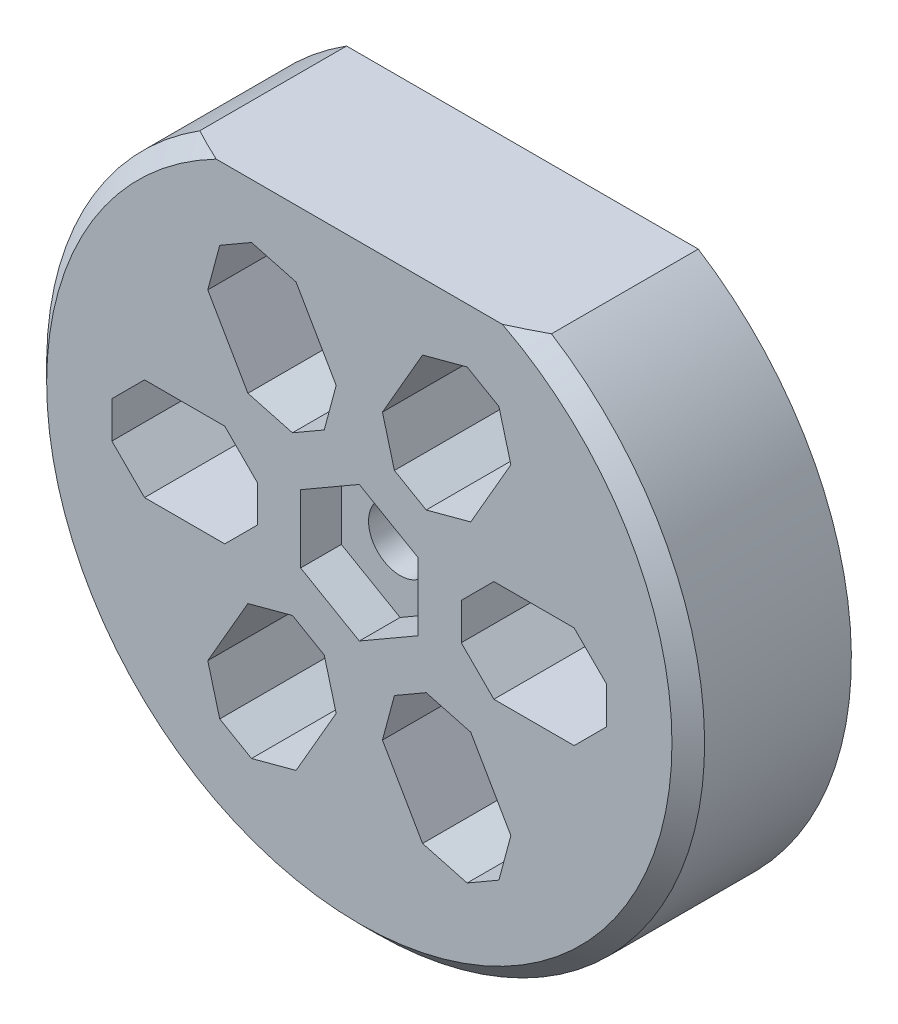
from build123d import *

# Parameters (mm, degrees)
BOSS_EXTRUDE1_DEPTH     = 12.7
CHAMFER1_SIZE           = 1.27
CUT_EXTRUDE1_DEPTH      = 3.175
F_8_CLEARANCE_HOLE1_D   = 4.9149
SKETCH5_W               = 11.3284
SKETCH5_H               = 7.9375
CUT_EXTRUDE_THIN1_DEPTH = 39.388001584
CHAMFER2_SIZE           = 2.54


with BuildPart() as part:
    # Sketch1 → Boss-Extrude1 (new body)
    with BuildSketch(Plane.XY):
        with BuildLine():
            Line((13.693796063, 21.648424474), (-13.693796063, 21.648424474))
            ThreePointArc((-13.693796063, 21.648424474), (0, -25.6159), (13.693796063, 21.648424474))
        make_face()
    extrude(amount=BOSS_EXTRUDE1_DEPTH)

    # Chamfer1
    chamfer1_edges = [part.edges().sort_by_distance(p)[0] for p in [
        (0, -25.6159, 12.7),
    ]]
    chamfer(chamfer1_edges, length=CHAMFER1_SIZE)

    # Sketch2 → Cut-Extrude1 (cut)
    with BuildSketch(Plane.XY.offset(12.7)):
        Polygon((-4.572, -2.639645431), (0, -5.279290861), (4.572, -2.639645431), (4.572, 2.639645431), (0, 5.279290861), (-4.572, 2.639645431), align=None)
    extrude(amount=-CUT_EXTRUDE1_DEPTH, mode=Mode.SUBTRACT)

    # #8 Clearance Hole1 (through all)
    with Locations(Plane.XY.offset(12.7)):
        with Locations((0, 0)):
            Hole(F_8_CLEARANCE_HOLE1_D / 2)

    # Sketch5 → Cut-Extrude-Thin1 (cut, through all)
    with BuildSketch(Plane.XY.offset(12.7)):
        Polygon((-7.405788321, -4.889701643), (-13.069988321, -14.700383827), (-6.195911679, -18.669133827), (-0.531711679, -8.858451643), align=None)
        with Locations((-13.6017, 0)):
            Rectangle(SKETCH5_W, SKETCH5_H)
        Polygon((-0.531711679, 8.858451643), (-6.195911679, 18.669133827), (-13.069988321, 14.700383827), (-7.405788321, 4.889701643), align=None)
        Polygon((7.405788321, 4.889701643), (13.069988321, 14.700383827), (6.195911679, 18.669133827), (0.531711679, 8.858451643), align=None)
        with Locations((13.6017, 0)):
            Rectangle(SKETCH5_W, SKETCH5_H)
        Polygon((0.531711679, -8.858451643), (6.195911679, -18.669133827), (13.069988321, -14.700383827), (7.405788321, -4.889701643), align=None)
    extrude(amount=-CUT_EXTRUDE_THIN1_DEPTH, mode=Mode.SUBTRACT)

    # Chamfer2
    chamfer2_edges = [part.edges().sort_by_distance(p)[0] for p in [
        (6.195911679, -18.669133827, 6.35),
        (0.531711679, -8.858451643, 6.35),
        (7.405788321, -4.889701643, 6.35),
        (13.069988321, -14.700383827, 6.35),
        (19.2659, -3.96875, 6.35),
        (7.9375, -3.96875, 6.35),
        (7.9375, 3.96875, 6.35),
        (19.2659, 3.96875, 6.35),
        (13.069988321, 14.700383827, 6.35),
        (7.405788321, 4.889701643, 6.35),
        (0.531711679, 8.858451643, 6.35),
        (6.195911679, 18.669133827, 6.35),
        (-6.195911679, 18.669133827, 6.35),
        (-0.531711679, 8.858451643, 6.35),
        (-7.405788321, 4.889701643, 6.35),
        (-13.069988321, 14.700383827, 6.35),
        (-19.2659, 3.96875, 6.35),
        (-7.9375, 3.96875, 6.35),
        (-7.9375, -3.96875, 6.35),
        (-19.2659, -3.96875, 6.35),
        (-13.069988321, -14.700383827, 6.35),
        (-7.405788321, -4.889701643, 6.35),
        (-0.531711679, -8.858451643, 6.35),
        (-6.195911679, -18.669133827, 6.35),
    ]]
    chamfer(chamfer2_edges, length=CHAMFER2_SIZE)


solid = part.part
